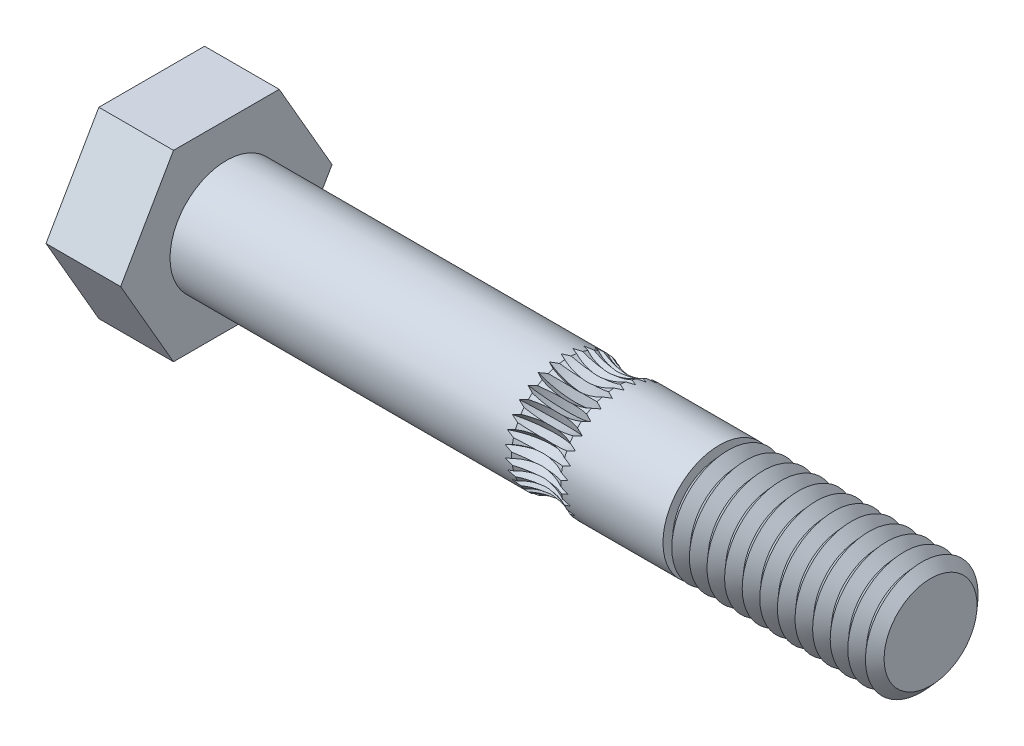
from build123d import *

# Parameters (mm, degrees)
SKETCH2_OUTSIDE_W  = 36.232
SKETCH2_OUTSIDE_H  = 36.232
CUT_EXTRUDE1_DEPTH = 67.81384587
CIRPATTERN1_COUNT  = 30
SKETCH4_R          = 8.784021567
CUT_EXTRUDE2_DEPTH = 10


with BuildPart() as part:
    # Sketch1 → Revolve1 (revolve)
    with BuildSketch(Plane.XY, mode=Mode.PRIVATE) as revolve1_sk:
        with BuildLine():
            Line((0, 0), (0, 10))
            Line((0, 10), (5.3, 10))
            Line((5.3, 10), (5.3, 4))
            Line((5.3, 4), (29.556440423, 4))
            ThreePointArc((29.556440423, 4), (31.3, 3.6), (33.043559577, 4))
            Line((33.043559577, 4), (40.3, 4))
            Line((40.3, 4), (40.3, 3.3))
            Line((40.3, 3.3), (40.925, 4))
            Line((40.925, 4), (41.55, 3.3))
            Line((41.55, 3.3), (42.175, 4))
            Line((42.175, 4), (42.8, 3.3))
            Line((42.8, 3.3), (43.425, 4))
            Line((43.425, 4), (44.05, 3.3))
            Line((44.05, 3.3), (44.675, 4))
            Line((44.675, 4), (45.3, 3.3))
            Line((45.3, 3.3), (45.925, 4))
            Line((45.925, 4), (46.55, 3.3))
            Line((46.55, 3.3), (47.175, 4))
            Line((47.175, 4), (47.8, 3.3))
            Line((47.8, 3.3), (48.425, 4))
            Line((48.425, 4), (49.05, 3.3))
            Line((49.05, 3.3), (49.675, 4))
            Line((49.675, 4), (50.3, 3.3))
            Line((50.3, 3.3), (50.925, 4))
            Line((50.925, 4), (51.55, 3.3))
            Line((51.55, 3.3), (52.175, 4))
            Line((52.175, 4), (52.8, 3.3))
            Line((52.8, 3.3), (53.425, 4))
            Line((53.425, 4), (54.05, 3.3))
            Line((54.05, 3.3), (54.675, 4))
            Line((54.675, 4), (55.3, 3.3))
            Line((55.3, 3.3), (55.925, 4))
            Line((55.925, 4), (56.55, 3.3))
            Line((56.55, 3.3), (57.175, 4))
            Line((57.175, 4), (57.8, 3.3))
            Line((57.8, 3.3), (58.425, 4))
            Line((58.425, 4), (59.05, 3.3))
            Line((59.05, 3.3), (59.675, 4))
            Line((59.675, 4), (60.3, 3.3))
            Line((60.3, 3.3), (60.925, 4))
            Line((60.925, 4), (61.55, 3.3))
            Line((61.55, 3.3), (62.175, 4))
            Line((62.175, 4), (62.8, 3.3))
            Line((62.8, 3.3), (63.425, 4))
            Line((63.425, 4), (64.05, 3.3))
            Line((64.05, 3.3), (64.675, 4))
            Line((64.675, 4), (65.3, 3.3))
            Line((65.3, 3.3), (65.3, 0))
            Line((65.3, 0), (0, 0))
        make_face()
    revolve(revolve1_sk.sketch.rotate(Axis((0, 0, 0), (1, 0, 0)), 90), axis=Axis((0, 0, 0), (1, 0, 0)))

    # Sketch2 outside → Cut-Extrude1 (cut, through all)
    with BuildSketch(Plane.ZY):
        Rectangle(SKETCH2_OUTSIDE_W, SKETCH2_OUTSIDE_H)
        Polygon((3.75277675, 6.5), (-3.75277675, 6.5), (-7.505553499, 0), (-3.75277675, -6.5), (3.75277675, -6.5), (7.505553499, 0), align=None, mode=Mode.SUBTRACT)
    extrude(amount=-CUT_EXTRUDE1_DEPTH, mode=Mode.SUBTRACT)

    # Sketch3 → Cut-Revolve1 (revolve, cut)
    with BuildSketch(Plane(origin=(31.3, 0, 0), x_dir=(0, 0, -1), z_dir=(1, 0, 0))):
        Polygon((0, 3), (0.5, 3.75), (-0.5, 3.75), align=None)
    cut_revolve1 = revolve(axis=Axis((31.3, 6, 1.918700795), (0, 0, -1)), mode=Mode.SUBTRACT)

    # CirPattern1: Cut-Revolve1 ×30 about axis
    cirpattern1_axis = Axis((0, 0, 0), (-1, 0, 0))
    for i in range(1, CIRPATTERN1_COUNT):
        add(cut_revolve1.rotate(cirpattern1_axis, i * 360 / CIRPATTERN1_COUNT), mode=Mode.SUBTRACT)

    # Sketch4 → Cut-Extrude2 (cut)
    with BuildSketch(Plane(origin=(65.3, 0, 0), x_dir=(0, 0, -1), z_dir=(1, 0, 0))):
        Circle(SKETCH4_R)
    extrude(amount=-CUT_EXTRUDE2_DEPTH, mode=Mode.SUBTRACT)


solid = part.part
